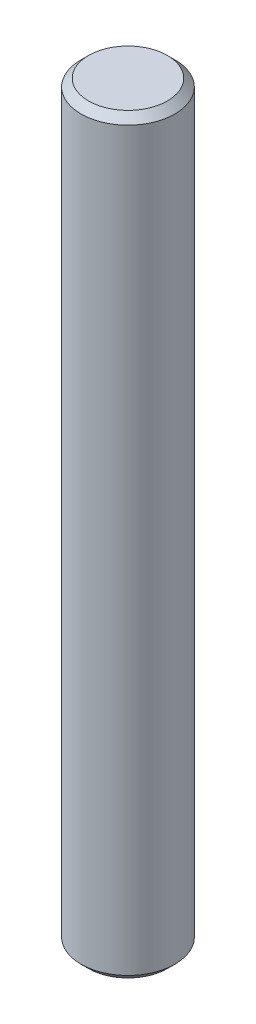
from build123d import *

# Parameters (mm, degrees)
SKETCH2_R           = 12.5
BOSS_EXTRUDE1_DEPTH = 200
CHAMFER1_SIZE       = 2


with BuildPart() as part:
    # Sketch2 → Boss-Extrude1 (new body)
    with BuildSketch(Plane(origin=(0, 0, 0), x_dir=(1, 0, 0), z_dir=(0, 1, 0))):
        with Locations(Location((0, 0, 0), (0, 0, 270))):
            Circle(SKETCH2_R)
    extrude(amount=BOSS_EXTRUDE1_DEPTH)

    # Chamfer1
    chamfer1_edges = [part.edges().sort_by_distance(p)[0] for p in [
        (0, 0, -12.5),
        (0, 200, -12.5),
    ]]
    chamfer(chamfer1_edges, length=CHAMFER1_SIZE)


solid = part.part
